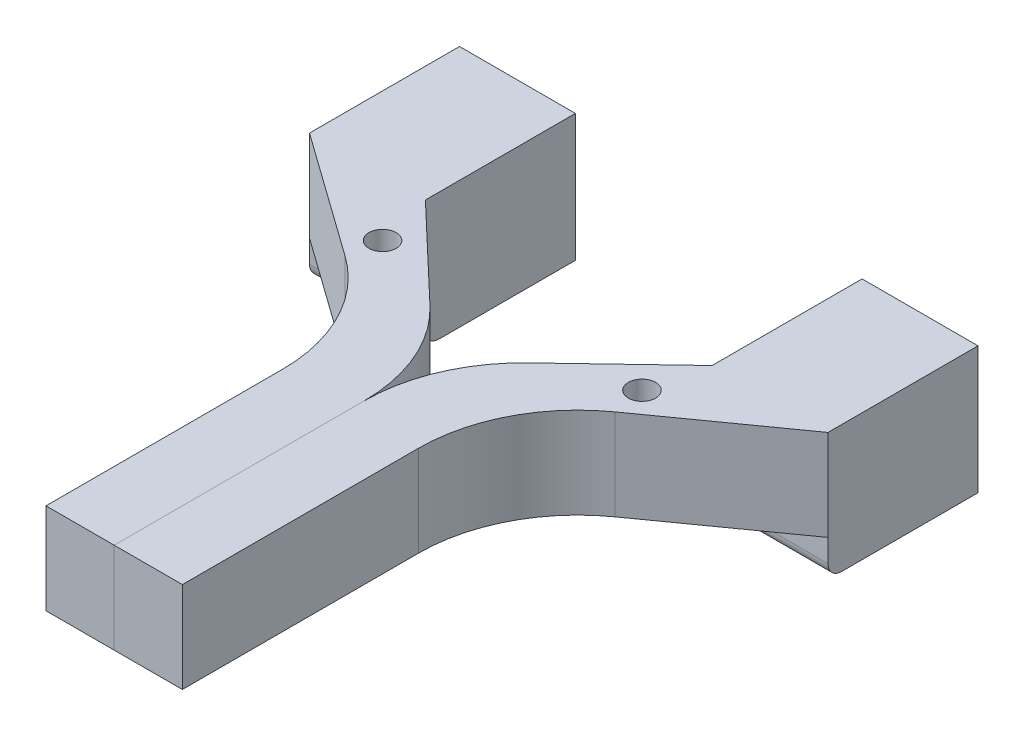
from build123d import *

# Parameters (mm, degrees)
SKETCH_1_W          = 25.5
SKETCH_1_H          = 28
SKETCH_1_W_2        = 12.5
SKETCH_1_H_2        = 22.6
EXTRUDE_1_DEPTH     = 30
SKETCH_2_W          = 25.5
SKETCH_2_H          = 28
EXTRUDE_2_DEPTH     = 3
EXTRUDE_4_DEPTH     = 20
FILLET_5_R          = 3
FILLET_7_R          = 35
SKETCH_8_R          = 3
CUT_EXTRUDE_1_DEPTH = 30


with BuildPart() as part:
    # 스케치1 → 보스-돌출1 (new body)
    with BuildSketch(Plane.XY):
        with Locations((-3.5, 0)):
            Rectangle(SKETCH_1_W, SKETCH_1_H)
        Rectangle(SKETCH_1_W_2, SKETCH_1_H_2, mode=Mode.SUBTRACT)
    extrude(amount=EXTRUDE_1_DEPTH)

    # 스케치2 → 보스-돌출2 (add)
    with BuildSketch(Plane.XY.offset(30)):
        with Locations((-3.5, 0)):
            Rectangle(SKETCH_2_W, SKETCH_2_H)
    extrude(amount=EXTRUDE_2_DEPTH)

    # 스케치7 → 보스-돌출4 (add)
    with BuildSketch(Plane(origin=(0, 14, 0), x_dir=(1, 0, 0), z_dir=(0, 1, 0))):
        Polygon((9.25, -33), (40.784552994, -63), (40.784552994, -133), (25.784552994, -133), (25.784552994, -63), (-16.25, -33), align=None)
    extrude(amount=-EXTRUDE_4_DEPTH)

    # 필렛5
    fillet_5_edges = [part.edges().sort_by_distance(p)[0] for p in [
        (-3.5, -14, 33),
    ]]
    fillet(fillet_5_edges, radius=FILLET_5_R)

    # 필렛7
    fillet_7_edges = [part.edges().sort_by_distance(p)[0] for p in [
        (40.784552994, 4, 63),
        (25.784552994, 4, 63),
    ]]
    fillet(fillet_7_edges, radius=FILLET_7_R)

    # 스케치8 → 컷-돌출1 (cut)
    with BuildSketch(Plane(origin=(0, 14, 0), x_dir=(1, 0, 0), z_dir=(0, 1, 0))):
        with Locations(Location((12.25, -45.426066506, 0), (0, 0, 270))):
            Circle(SKETCH_8_R)
    extrude(amount=-CUT_EXTRUDE_1_DEPTH, mode=Mode.SUBTRACT)


with BuildPart() as body_2:
    # 대칭 복사3: mirrored copy
    add(part.part.mirror(Plane(origin=(40.784552994, -6, 133), x_dir=(0, 0, 1), z_dir=(1, 0, 0))))


solid = Compound([part.part, body_2.part])
